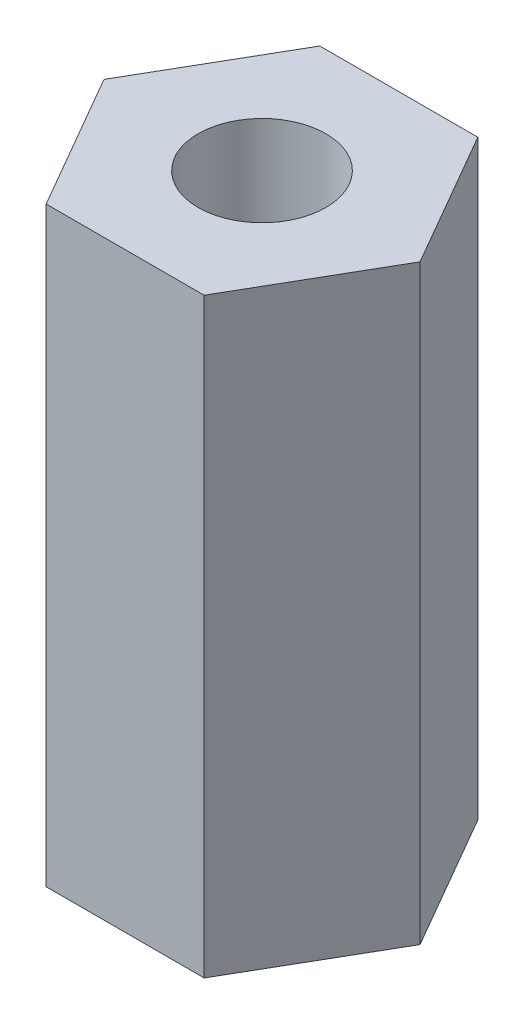
from build123d import *

# Parameters (mm, degrees)
SALIENTE_EXTRUIR1_DEPTH = 14.8
CORTAR_EXTRUIR1_DEPTH   = 10.05
CROQUIS2_R              = 1.6
CORTAR_EXTRUIR2_DEPTH   = 5


with BuildPart() as part:
    # Croquis1 → Saliente-Extruir1 (new body)
    with BuildSketch(Plane(origin=(0, 0, 0), x_dir=(1, 0, 0), z_dir=(0, 1, 0))):
        Polygon((1.977424672, -3.425), (3.954849344, 0), (1.977424672, 3.425), (-1.977424672, 3.425), (-3.954849344, 0), (-1.977424672, -3.425), align=None)
    extrude(amount=SALIENTE_EXTRUIR1_DEPTH)

    # Croquis1<3> → Cortar-Extruir1 (cut)
    with BuildSketch(Plane(origin=(0, 0, 0), x_dir=(1, 0, 0), z_dir=(0, 1, 0))):
        Polygon((-1.400074403, -2.425), (1.400074403, -2.425), (2.800148806, 0), (1.400074403, 2.425), (-1.400074403, 2.425), (-2.800148806, 0), align=None)
    extrude(amount=CORTAR_EXTRUIR1_DEPTH, mode=Mode.SUBTRACT)

    # Croquis2 → Cortar-Extruir2 (cut)
    with BuildSketch(Plane(origin=(0, 14.8, 0), x_dir=(1, 0, 0), z_dir=(0, 1, 0))):
        Circle(CROQUIS2_R)
    extrude(amount=-CORTAR_EXTRUIR2_DEPTH, mode=Mode.SUBTRACT)


solid = part.part
